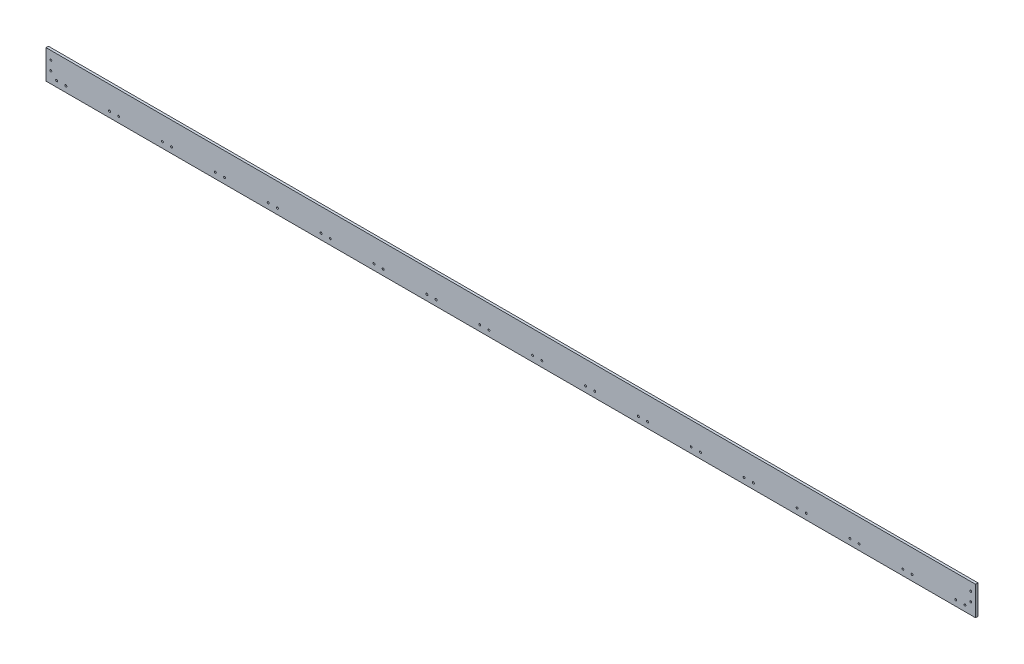
from build123d import *

# Parameters (mm, degrees)
SKETCH1_W           = 2438.4
SKETCH1_H           = 76.2
BOSS_EXTRUDE1_DEPTH = 6.35
SKETCH2_R           = 2.54
CUT_EXTRUDE1_DEPTH  = 6.35
SKETCH3_R           = 2.54
CUT_EXTRUDE2_DEPTH  = 6.35
LPATTERN2_COUNT     = 18
LPATTERN2_PITCH     = 138.728823529


with BuildPart() as part:
    # Sketch1 → Boss-Extrude1 (new body)
    with BuildSketch(Plane.XY):
        with Locations((1219.2, 38.1)):
            Rectangle(SKETCH1_W, SKETCH1_H)
    extrude(amount=BOSS_EXTRUDE1_DEPTH)

    # Sketch2 → Cut-Extrude1 (cut)
    with BuildSketch(Plane.XY.offset(6.35)):
        with Locations((27.94, 15.24)):
            Circle(SKETCH2_R)
        with Locations((52.07, 15.24)):
            Circle(SKETCH2_R)
    cut_extrude1 = extrude(amount=-CUT_EXTRUDE1_DEPTH, mode=Mode.SUBTRACT)

    # Sketch3 → Cut-Extrude2 (cut)
    with BuildSketch(Plane.XY.offset(6.35)):
        with Locations((12.7, 29.845)):
            Circle(SKETCH3_R)
        with Locations((12.7, 53.975)):
            Circle(SKETCH3_R)
        with Locations(Location((2425.7, 29.845, 0), (0, 0, 180))):
            Circle(SKETCH3_R)
        with Locations(Location((2425.7, 53.975, 0), (0, 0, 180))):
            Circle(SKETCH3_R)
    extrude(amount=-CUT_EXTRUDE2_DEPTH, mode=Mode.SUBTRACT)

    # LPattern2: Cut-Extrude1 ×18
    with Locations(*[(i * LPATTERN2_PITCH, 0, 0) for i in range(1, LPATTERN2_COUNT)]):
        add(cut_extrude1, mode=Mode.SUBTRACT)


solid = part.part
